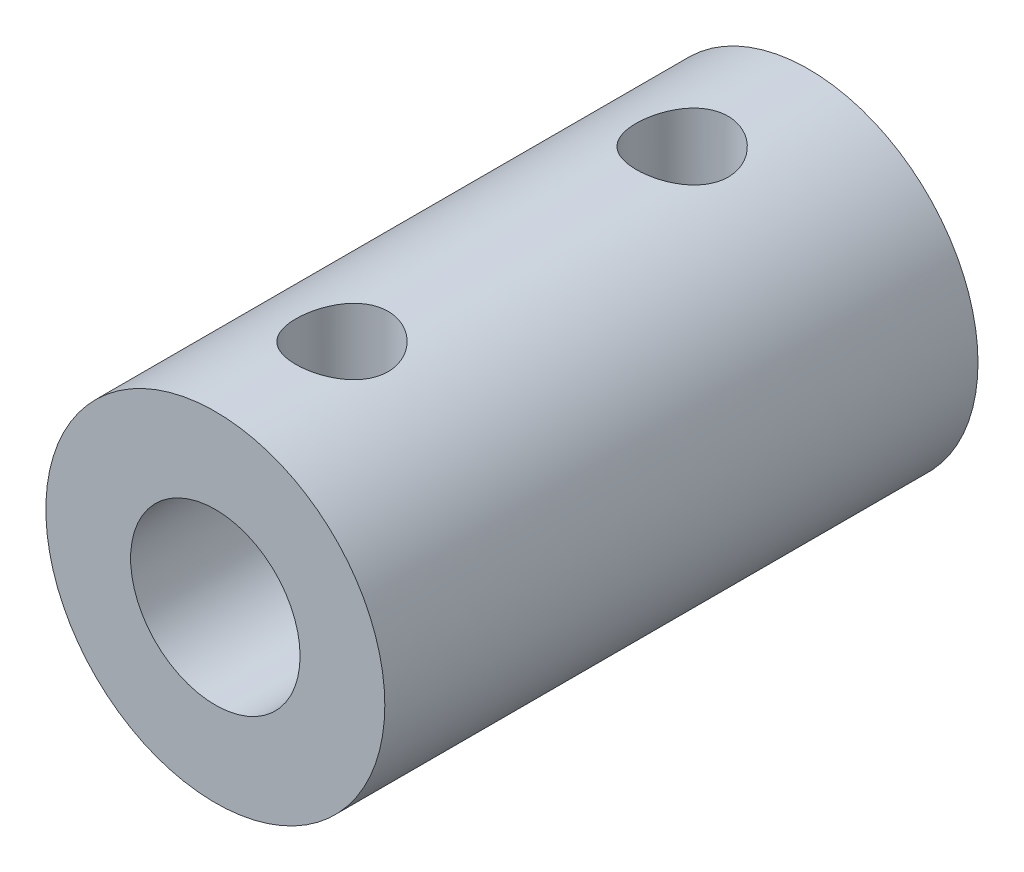
from build123d import *

# Parameters (mm, degrees)
SKETCH1_R                           = 6.35
BOSS_EXTRUDE1_DEPTH                 = 22.225
SKETCH2_R                           = 3.175
THICK_DEPTH                         = 12.7
SKETCH3_R                           = 2.38125
THIN_DEPTH                          = 12.7
F_8_32_TAPPED_HOLE2_REACH           = 24.512
F_8_32_TAPPED_HOLE2_BORE_R          = 1.7272
F_8_32_TAPPED_HOLE2_ON_FACE_2_REACH = 24.515
F_8_32_TAPPED_HOLE2_BORE_2_R        = 1.7272


with BuildPart() as part:
    # Sketch1 → Boss-Extrude1 (new body)
    with BuildSketch(Plane.XY):
        Circle(SKETCH1_R)
    extrude(amount=BOSS_EXTRUDE1_DEPTH)

    # Sketch2 → Thick (cut)
    with BuildSketch(Plane.XY.offset(22.225)):
        Circle(SKETCH2_R)
    extrude(amount=-THICK_DEPTH, mode=Mode.SUBTRACT)

    # Sketch3 → Thin (cut)
    with BuildSketch(Plane(origin=(0, 0, 0), x_dir=(-1, 0, 0), z_dir=(0, 0, -1))):
        Circle(SKETCH3_R)
    extrude(amount=-THIN_DEPTH, mode=Mode.SUBTRACT)

    # #8-32 Tapped Hole2 bore (on position points) → #8-32 Tapped Hole2 (cut, up to next)
    with BuildSketch(Plane(origin=(-0.017626293, 6.349975536, 17.4625), x_dir=(0.999996147476, 0.002775794184, 0), z_dir=(-0.002775794184, 0.999996147476, 0)), mode=Mode.PRIVATE) as f_8_32_tapped_hole2_sk1:
        Circle(F_8_32_TAPPED_HOLE2_BORE_R)
    f_8_32_tapped_hole2_tool1 = extrude(f_8_32_tapped_hole2_sk1.sketch, amount=-F_8_32_TAPPED_HOLE2_REACH, mode=Mode.PRIVATE) & part.part
    add(f_8_32_tapped_hole2_tool1.solids().sort_by_distance((-0.017626, 6.349976, 17.4625))[0], mode=Mode.SUBTRACT)

    # #8-32 Tapped Hole2 bore 2 (on position points) → #8-32 Tapped Hole2 on face 2 (cut, up to next)
    with BuildSketch(Plane(origin=(0.028231467, 6.349937243, 4.7625), x_dir=(0.999990116491, -0.004446000518, 0), z_dir=(0.004446000518, 0.999990116491, 0)), mode=Mode.PRIVATE) as f_8_32_tapped_hole2_on_face_2_sk1:
        Circle(F_8_32_TAPPED_HOLE2_BORE_2_R)
    f_8_32_tapped_hole2_on_face_2_tool1 = extrude(f_8_32_tapped_hole2_on_face_2_sk1.sketch, amount=-F_8_32_TAPPED_HOLE2_ON_FACE_2_REACH, mode=Mode.PRIVATE) & part.part
    add(f_8_32_tapped_hole2_on_face_2_tool1.solids().sort_by_distance((0.028231, 6.349937, 4.7625))[0], mode=Mode.SUBTRACT)


solid = part.part
